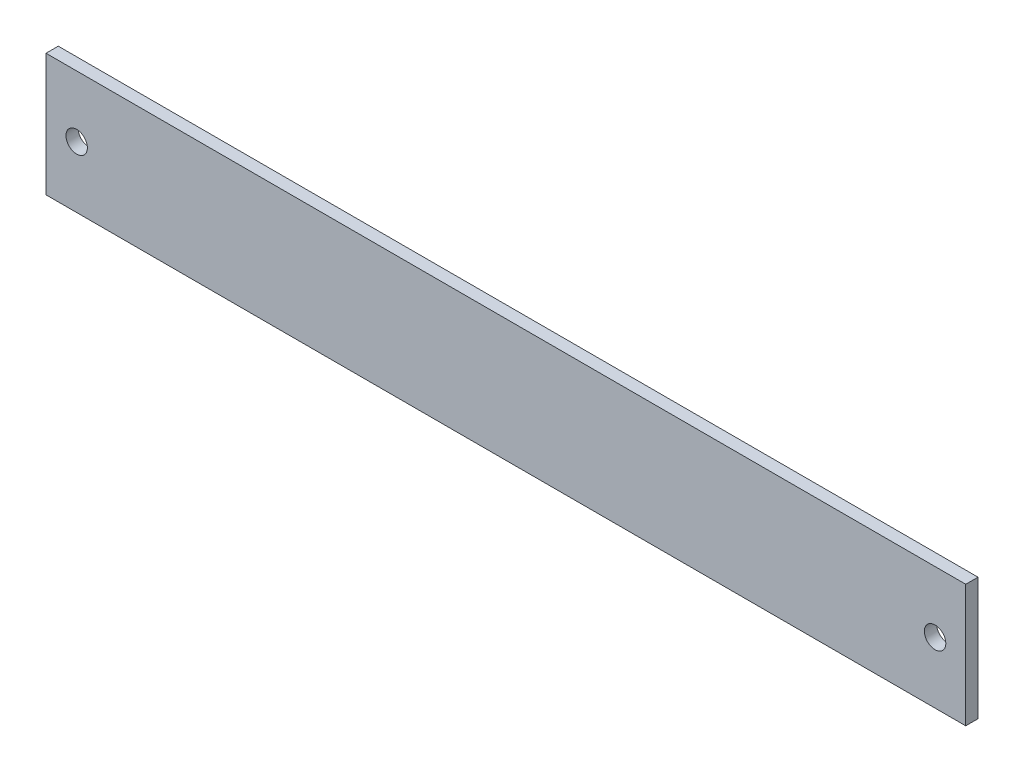
from build123d import *

# Parameters (mm, degrees)
SKETCH1_W           = 150
SKETCH1_H           = 20
BOSS_EXTRUDE1_DEPTH = 2
CUT_EXTRUDE1_REACH  = 77.69
SKETCH2_R           = 1.75


with BuildPart() as part:
    # Sketch1 → Boss-Extrude1 (new body)
    with BuildSketch(Plane.XY):
        Rectangle(SKETCH1_W, SKETCH1_H)
    extrude(amount=BOSS_EXTRUDE1_DEPTH)

    # Sketch2 → Cut-Extrude1 (cut, up to next)
    with BuildSketch(Plane.XY.offset(2), mode=Mode.PRIVATE) as cut_extrude1_sk1:
        with Locations((-70, 0)):
            Circle(SKETCH2_R)
    cut_extrude1_tool1 = extrude(cut_extrude1_sk1.sketch, amount=-CUT_EXTRUDE1_REACH, mode=Mode.PRIVATE) & part.part
    # Sketch2 → Cut-Extrude1 (cut, up to next)
    with BuildSketch(Plane.XY.offset(2), mode=Mode.PRIVATE) as cut_extrude1_sk2:
        with Locations(Location((70, 0, 0), (0, 0, 180))):
            Circle(SKETCH2_R)
    cut_extrude1_tool2 = extrude(cut_extrude1_sk2.sketch, amount=-CUT_EXTRUDE1_REACH, mode=Mode.PRIVATE) & part.part
    add(cut_extrude1_tool1.solids().sort_by_distance((-70, 0, 2))[0], mode=Mode.SUBTRACT)
    add(cut_extrude1_tool2.solids().sort_by_distance((70, 0, 2))[0], mode=Mode.SUBTRACT)


solid = part.part
